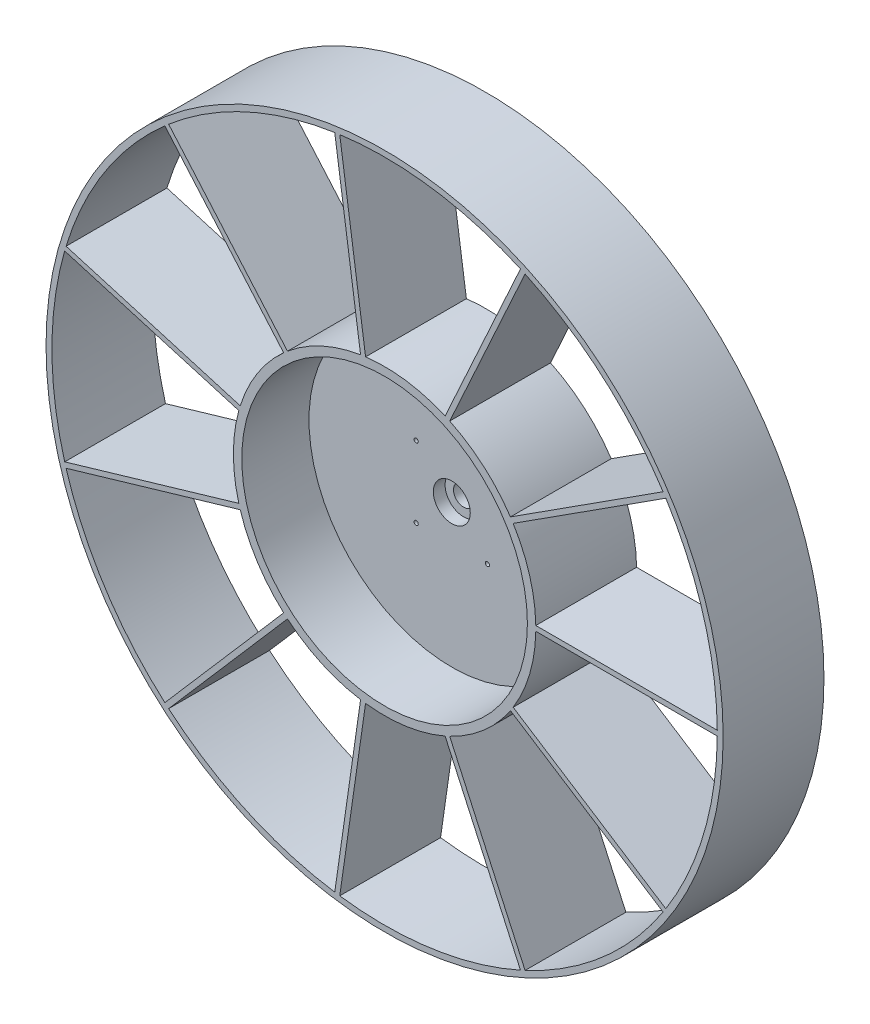
from build123d import *

# Parameters (mm, degrees)
SKETCH1_R               = 201.5
SKETCH1_R_2             = 198
RING_DEPTH              = 60
SKETCH2_R               = 90
FLOOR_2_DEPTH           = 20
SKETCH3_R               = 90
SKETCH3_R_2             = 85
HUB_TUBE_DEPTH          = 40
SKETCH4_W               = 110
SKETCH4_H               = 3
VANES_DEPTH             = 60
SKETCH5_R               = 6
BORE_DEPTH              = 20
SKETCH6_R               = 11
BEARING_SEAT_LOW_DEPTH  = 7
SKETCH7_R               = 11
BEARING_SEAT_HIGH_DEPTH = 7
SKETCH8_R               = 1.25
GROMMET_SCREWS_DEPTH    = 8


with BuildPart() as part:
    # Sketch1 → Ring (new body)
    with BuildSketch(Plane.XY):
        Circle(SKETCH1_R)
        Circle(SKETCH1_R_2, mode=Mode.SUBTRACT)
    extrude(amount=RING_DEPTH)



with BuildPart() as body_2:
    # Sketch2 → Floor 2 (new body)
    with BuildSketch(Plane.XY):
        Circle(SKETCH2_R)
    extrude(amount=FLOOR_2_DEPTH)

    # Sketch3 → Hub_tube (add)
    with BuildSketch(Plane.XY.offset(20)):
        Circle(SKETCH3_R)
        Circle(SKETCH3_R_2, mode=Mode.SUBTRACT)
    extrude(amount=HUB_TUBE_DEPTH)


with BuildPart() as part_1:
    add(part.part)

    add(body_2.part)  # Vanes merges body 2
    # Sketch4 → Vanes (add)
    with BuildSketch(Plane.XY):
        with Locations((144, 0)):
            Rectangle(SKETCH4_W, SKETCH4_H)
        Polygon((75.682525648, 46.855152454), (168.22041426, 106.325642374), (166.598491807, 108.849402973), (74.060603196, 49.378913053), align=None)
        Polygon((38.33638415, 80.334125067), (84.03203558, 180.393644556), (81.303139594, 181.639889595), (35.607488164, 81.580370106), align=None)
        Polygon((-11.181288444, 88.307580585), (-26.835920654, 197.187939192), (-29.805384979, 196.760994677), (-14.150752769, 87.88063607), align=None)
        Polygon((-57.14898096, 68.244003218), (-129.183661694, 151.376456397), (-131.450910417, 149.411874196), (-59.416229683, 66.279421017), align=None)
        Polygon((-84.972275816, 26.513437019), (-190.516502914, 57.504018272), (-191.361700585, 54.625539351), (-85.817473487, 23.634958098), align=None)
        Polygon((-85.817473487, -23.634958098), (-191.361700585, -54.625539351), (-190.516502914, -57.504018272), (-84.972275816, -26.513437019), align=None)
        Polygon((-59.416229683, -66.279421017), (-131.450910417, -149.411874196), (-129.183661694, -151.376456397), (-57.14898096, -68.244003218), align=None)
        Polygon((-14.150752769, -87.88063607), (-29.805384979, -196.760994677), (-26.835920654, -197.187939192), (-11.181288444, -88.307580585), align=None)
        Polygon((35.607488164, -81.580370106), (81.303139594, -181.639889595), (84.03203558, -180.393644556), (38.33638415, -80.334125067), align=None)
        Polygon((74.060603196, -49.378913053), (166.598491807, -108.849402973), (168.22041426, -106.325642374), (75.682525648, -46.855152454), align=None)
    extrude(amount=VANES_DEPTH)

    # Sketch5 → Bore (cut)
    with BuildSketch(Plane.XY):
        Circle(SKETCH5_R)
    extrude(amount=BORE_DEPTH, mode=Mode.SUBTRACT)

    # Sketch6 → Bearing_seat_low (cut)
    with BuildSketch(Plane.XY):
        Circle(SKETCH6_R)
    extrude(amount=BEARING_SEAT_LOW_DEPTH, mode=Mode.SUBTRACT)

    # Sketch7 → Bearing_seat_high (cut)
    with BuildSketch(Plane.XY.offset(13)):
        Circle(SKETCH7_R)
    extrude(amount=BEARING_SEAT_HIGH_DEPTH, mode=Mode.SUBTRACT)

    # Sketch8 → Grommet_screws (cut)
    with BuildSketch(Plane.XY.offset(12)):
        with Locations((21.213203436, 21.213203436)):
            Circle(SKETCH8_R)
        with Locations((-21.213203436, 21.213203436)):
            Circle(SKETCH8_R)
        with Locations((-21.213203436, -21.213203436)):
            Circle(SKETCH8_R)
        with Locations((21.213203436, -21.213203436)):
            Circle(SKETCH8_R)
    extrude(amount=GROMMET_SCREWS_DEPTH, mode=Mode.SUBTRACT)


solid = part_1.part
